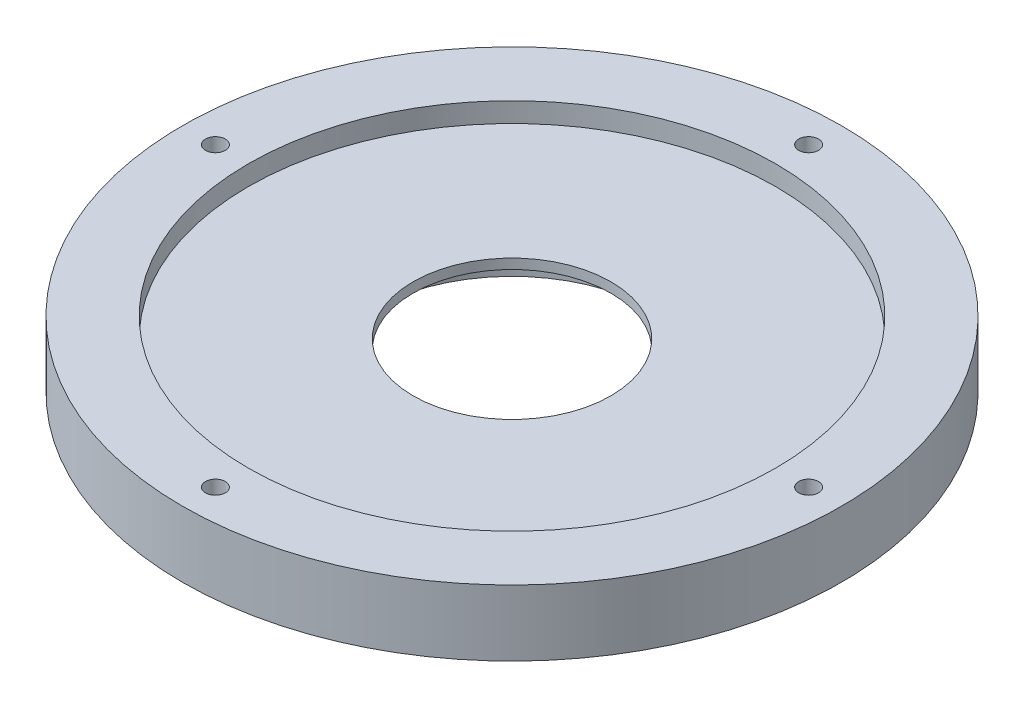
from build123d import *

# Parameters (mm, degrees)
SKETCH_2_R          = 100
SKETCH_2_R_2        = 3
SKETCH_2_R_3        = 30
EXTRUDE_1_DEPTH     = 20
SKETCH_3_R          = 43
CUT_EXTRUDE_1_DEPTH = 11
SKETCH_4_R          = 80
CUT_EXTRUDE_2_DEPTH = 6


with BuildPart() as part:
    # 草图2 → 凸台-拉伸1 (new body)
    with BuildSketch(Plane(origin=(0, 0, 0), x_dir=(1, 0, 0), z_dir=(0, 1, 0))):
        with Locations(Location((0, 0, 0), (0, 0, 270))):
            Circle(SKETCH_2_R)
        with Locations(Location((0, 90, 0), (0, 0, 270))):
            Circle(SKETCH_2_R_2, mode=Mode.SUBTRACT)
        with Locations(Location((90, 0, 0), (0, 0, 270))):
            Circle(SKETCH_2_R_2, mode=Mode.SUBTRACT)
        with Locations(Location((0, -90, 0), (0, 0, 270))):
            Circle(SKETCH_2_R_2, mode=Mode.SUBTRACT)
        with Locations(Location((-90, 0, 0), (0, 0, 270))):
            Circle(SKETCH_2_R_2, mode=Mode.SUBTRACT)
        with Locations(Location((0, 0, 0), (0, 0, 270))):
            Circle(SKETCH_2_R_3, mode=Mode.SUBTRACT)
    extrude(amount=EXTRUDE_1_DEPTH)

    # 草图3 → 切除-拉伸1 (cut)
    with BuildSketch(Plane.XZ):
        with Locations(Location((0, 0, 0), (0, 0, 270))):
            Circle(SKETCH_3_R)
    extrude(amount=-CUT_EXTRUDE_1_DEPTH, mode=Mode.SUBTRACT)

    # 草图4 → 切除-拉伸2 (cut)
    with BuildSketch(Plane(origin=(0, 20, 0), x_dir=(1, 0, 0), z_dir=(0, 1, 0))):
        with Locations(Location((0, 0, 0), (0, 0, 270))):
            Circle(SKETCH_4_R)
    extrude(amount=-CUT_EXTRUDE_2_DEPTH, mode=Mode.SUBTRACT)


solid = part.part
